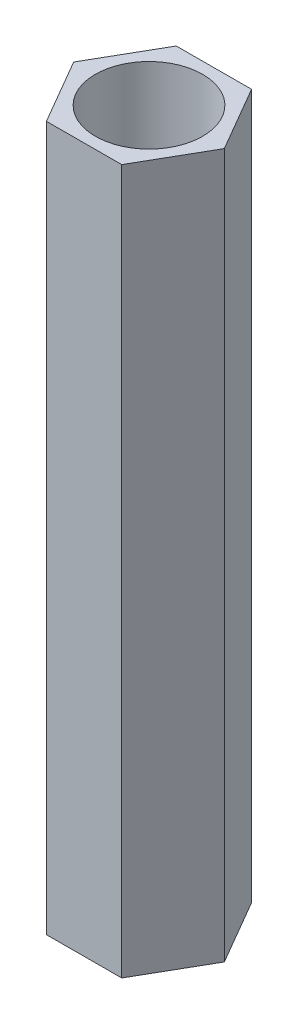
from build123d import *

# Parameters (mm, degrees)
SKETCH1_R           = 1.65
BOSS_EXTRUDE1_DEPTH = 21.65


with BuildPart() as part:
    # Sketch1 → Boss-Extrude1 (new body)
    with BuildSketch(Plane(origin=(0, 0, 0), x_dir=(1, 0, 0), z_dir=(0, 1, 0))):
        Polygon((1.159632305, -1.997144524), (2.309394045, 0.005698773), (1.149761741, 2.002843297), (-1.159632305, 1.997144524), (-2.309394045, -0.005698773), (-1.149761741, -2.002843297), align=None)
        with Locations(Location((0, 0, 0), (0, 0, 90))):
            Circle(SKETCH1_R, mode=Mode.SUBTRACT)
    extrude(amount=BOSS_EXTRUDE1_DEPTH)


solid = part.part
